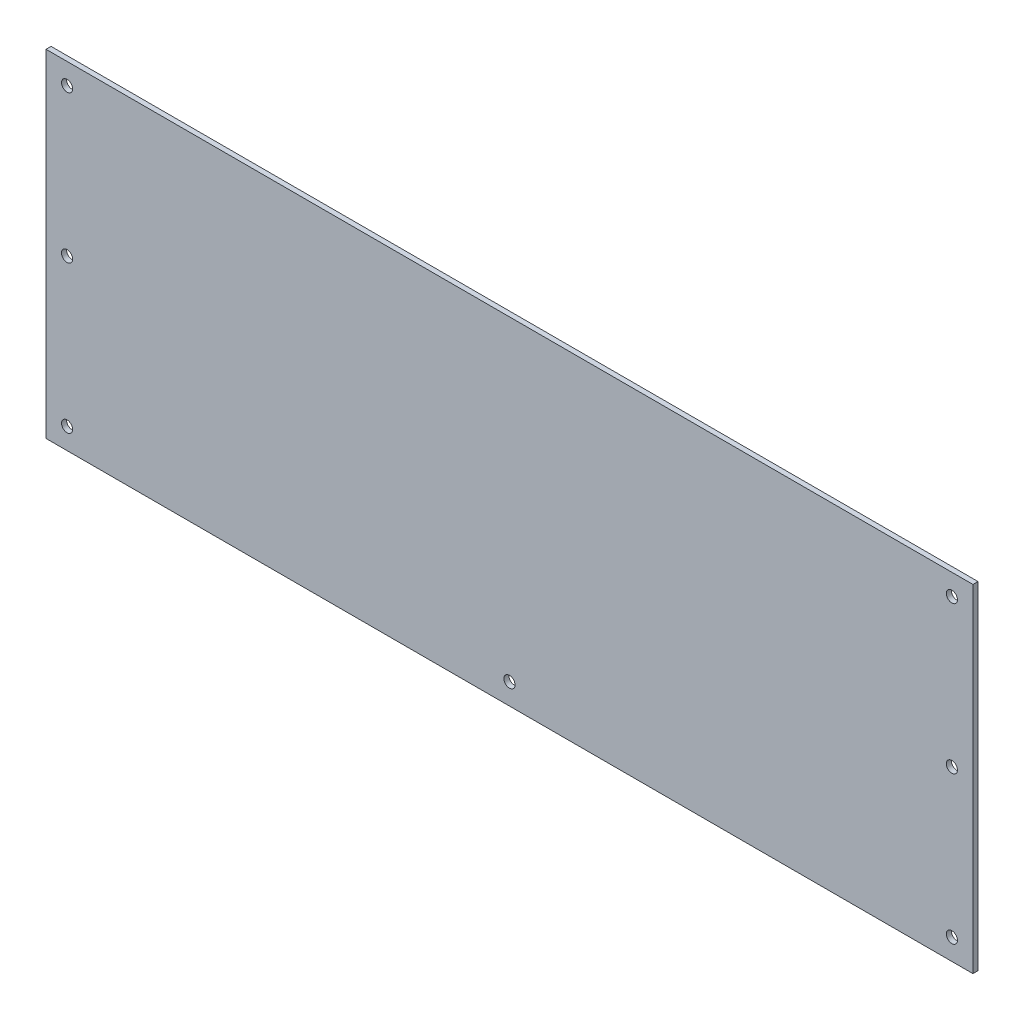
from build123d import *

# Parameters (mm, degrees)
SKETCH1_W            = 550
SKETCH1_H            = 200
BOSS_EXTRUDE1_DEPTH  = 3
M6_CLEARANCE_HOLE1_D = 6.6


with BuildPart() as part:
    # Sketch1 → Boss-Extrude1 (new body)
    with BuildSketch(Plane.XY):
        with Locations((275, 100)):
            Rectangle(SKETCH1_W, SKETCH1_H)
    extrude(amount=BOSS_EXTRUDE1_DEPTH)

    # M6 Clearance Hole1 (through all)
    with Locations(Plane.XY.offset(3)):
        with Locations((12.5, 100), (12.5, 187.5), (12.5, 12.5), (275, 12.5), (537.5, 12.5), (537.5, 100), (537.5, 187.5)):
            Hole(M6_CLEARANCE_HOLE1_D / 2)


solid = part.part
